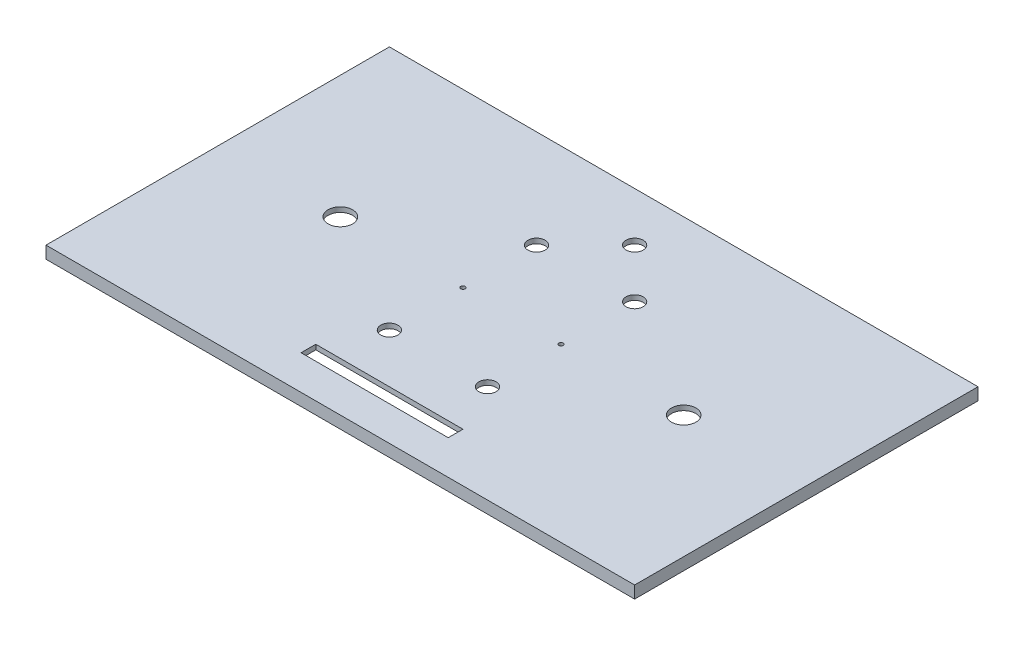
from build123d import *

# Parameters (mm, degrees)
SKETCH1_W                 = 304.8
SKETCH1_H                 = 177.8
BOSS_EXTRUDE1_DEPTH       = 101.6
SHELL1_T                  = 2.54
SKETCH3_R                 = 6.35
CUT_EXTRUDE1_DEPTH        = 2.54
F_4_40_TAPPED_HOLE1_D     = 2.2606
F_4_40_TAPPED_HOLE1_DEPTH = 2.54
SKETCH11_R                = 4.445
CUT_EXTRUDE2_DEPTH        = 2.54
SKETCH12_R                = 4.445
SKETCH12_W                = 76.2
SKETCH12_H                = 7.62
CUT_EXTRUDE3_DEPTH        = 2.54
SKETCH13_R                = 10.659380334
CUT_EXTRUDE4_DEPTH        = 2.54
SKETCH14_W                = 177.8
SKETCH14_H                = 95.25
CUT_EXTRUDE5_DEPTH        = 334.35988061


with BuildPart() as part:
    # Sketch1 → Boss-Extrude1 (new body)
    with BuildSketch(Plane(origin=(0, 0, 0), x_dir=(1, 0, 0), z_dir=(0, 1, 0))):
        Rectangle(SKETCH1_W, SKETCH1_H)
    extrude(amount=BOSS_EXTRUDE1_DEPTH)

    # Shell1 (no face opened: a closed hollow body)
    add(offset(amount=-SHELL1_T, mode=Mode.PRIVATE), mode=Mode.SUBTRACT)

    # Sketch3 → Cut-Extrude1 (cut)
    with BuildSketch(Plane(origin=(0, 101.6, 0), x_dir=(1, 0, 0), z_dir=(0, 1, 0))):
        with Locations(Location((-88.9, 0, 0), (0, 0, 270))):
            Circle(SKETCH3_R)
        with Locations(Location((88.9, 0, 0), (0, 0, 270))):
            Circle(SKETCH3_R)
    extrude(amount=-CUT_EXTRUDE1_DEPTH, mode=Mode.SUBTRACT)

    # #4-40 Tapped Hole1
    with Locations(Plane(origin=(0, 101.6, 0), x_dir=(1, 0, 0), z_dir=(0, 1, 0))):
        with Locations((-25.4, 0), (25.4, 0)):
            Hole(F_4_40_TAPPED_HOLE1_D / 2, depth=F_4_40_TAPPED_HOLE1_DEPTH)

    # Sketch11 → Cut-Extrude2 (cut)
    with BuildSketch(Plane(origin=(0, 101.6, 0), x_dir=(1, 0, 0), z_dir=(0, 1, 0))):
        with Locations(Location((-25.4, 38.1, 0), (0, 0, 270))):
            Circle(SKETCH11_R)
        with Locations(Location((25.4, 38.1, 0), (0, 0, 270))):
            Circle(SKETCH11_R)
        with Locations(Location((25.4, -38.1, 0), (0, 0, 270))):
            Circle(SKETCH11_R)
        with Locations(Location((-25.4, -38.1, 0), (0, 0, 270))):
            Circle(SKETCH11_R)
    extrude(amount=-CUT_EXTRUDE2_DEPTH, mode=Mode.SUBTRACT)

    # Sketch12 → Cut-Extrude3 (cut)
    with BuildSketch(Plane(origin=(0, 101.6, 0), x_dir=(1, 0, 0), z_dir=(0, 1, 0))):
        with Locations(Location((0, 63.5, 0), (0, 0, 270))):
            Circle(SKETCH12_R)
        with Locations((0, -67.31)):
            Rectangle(SKETCH12_W, SKETCH12_H)
    extrude(amount=-CUT_EXTRUDE3_DEPTH, mode=Mode.SUBTRACT)

    # Sketch13 → Cut-Extrude4 (cut)
    with BuildSketch(Plane.XY.offset(88.9)):
        with Locations((0, 50.8)):
            Circle(SKETCH13_R)
    extrude(amount=-CUT_EXTRUDE4_DEPTH, mode=Mode.SUBTRACT)

    # Sketch14 → Cut-Extrude5 (cut, through all)
    with BuildSketch(Plane.ZY.offset(152.4)):
        with Locations((0, 47.625)):
            Rectangle(SKETCH14_W, SKETCH14_H)
    extrude(amount=-CUT_EXTRUDE5_DEPTH, mode=Mode.SUBTRACT)


solid = part.part
